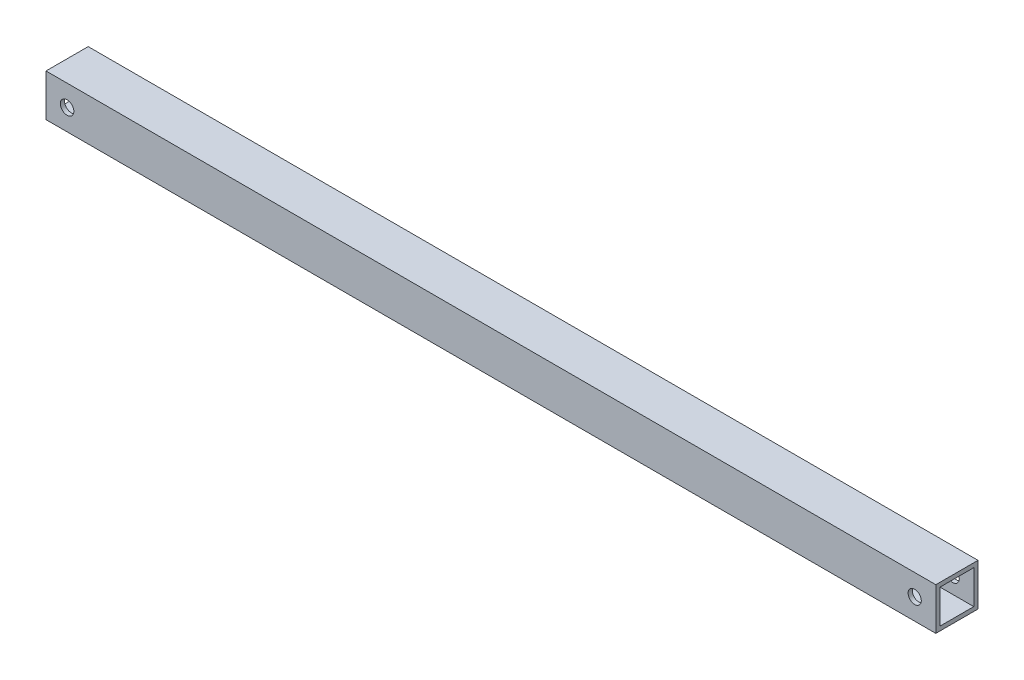
from build123d import *

# Parameters (mm, degrees)
SKETCH_1_W          = 210.89955229
SKETCH_1_H          = 10
SKETCH_1_R          = 1.6
SKETCH_1_R_2        = 1.559795767
EXTRUDE_1_DEPTH     = 10
SKETCH_2_W          = 8
SKETCH_2_H          = 8
CUT_EXTRUDE_1_DEPTH = 507.140910376


with BuildPart() as part:
    # ｽｹｯﾁ1 → ﾎﾞｽ - 押し出し1 (new body)
    with BuildSketch(Plane.XY):
        with Locations((-466.84495805, 455)):
            Rectangle(SKETCH_1_W, SKETCH_1_H)
        with Locations((-567.294734195, 455)):
            Circle(SKETCH_1_R, mode=Mode.SUBTRACT)
        with Locations((-366.395181905, 454.995481815)):
            Circle(SKETCH_1_R_2, mode=Mode.SUBTRACT)
    extrude(amount=EXTRUDE_1_DEPTH)

    # ｽｹｯﾁ2 → ｶｯﾄ - 押し出し1 (cut, through all)
    with BuildSketch(Plane.ZY.offset(572.294734195)):
        with Locations((5, 455)):
            Rectangle(SKETCH_2_W, SKETCH_2_H)
    extrude(amount=-CUT_EXTRUDE_1_DEPTH, mode=Mode.SUBTRACT)


solid = part.part
